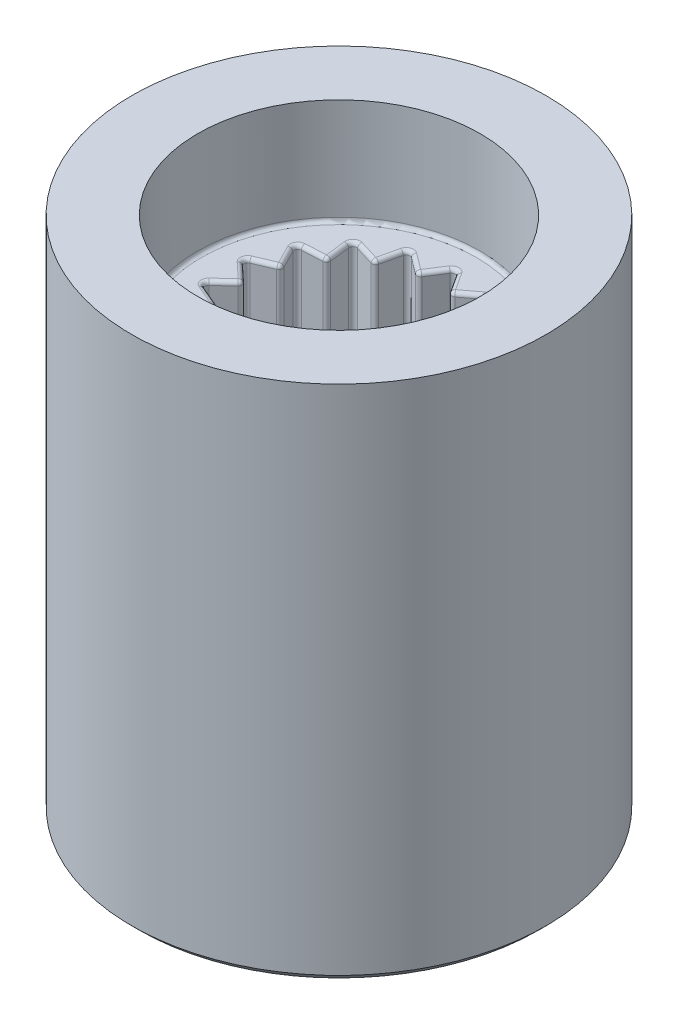
from build123d import *

# Parameters (mm, degrees)
SKETCH2_R           = 5.5
SKETCH2_R_2         = 3.75
BOSS_EXTRUDE1_DEPTH = 13.7
SKETCH3_R           = 4.607658028
BOSS_EXTRUDE2_DEPTH = 10.9
FILLET1_R           = 0.1
EXTRUDE_START       = 0.1
SKETCH_1_R          = 5.5
EXTRUDE_1_DEPTH     = 0.1
CHAMFER_1_SIZE      = 0.2


with BuildPart() as part:
    # Sketch2 → Boss-Extrude1 (new body)
    with BuildSketch(Plane(origin=(0, 0, 0), x_dir=(1, 0, 0), z_dir=(0, 1, 0))):
        with Locations(Location((0, 0, 0), (0, 0, 90))):
            Circle(SKETCH2_R)
        with Locations(Location((0, 0, 0), (0, 0, 90))):
            Circle(SKETCH2_R_2, mode=Mode.SUBTRACT)
    extrude(amount=BOSS_EXTRUDE1_DEPTH)

    # Sketch3 → Boss-Extrude2 (add)
    with BuildSketch(Plane(origin=(0, 0, 0), x_dir=(1, 0, 0), z_dir=(0, 1, 0))):
        Circle(SKETCH3_R)
        Polygon((0, 3.167239607), (0.439078531, 2.490138093), (1.083259744, 2.976231687), (1.264276243, 2.189790688), (2.035862376, 2.426246301), (1.936983582, 1.625322209), (2.74290996, 1.583619804), (2.376062113, 0.864815884), (3.119122121, 0.549985386), (2.528552487, 0), (3.119122121, -0.549985386), (2.376062113, -0.864815884), (2.74290996, -1.583619804), (1.936983582, -1.625322209), (2.035862376, -2.426246301), (1.264276243, -2.189790688), (1.083259744, -2.976231687), (0.439078531, -2.490138093), (0, -3.167239607), (-0.439078531, -2.490138093), (-1.083259744, -2.976231687), (-1.264276243, -2.189790688), (-2.035862376, -2.426246301), (-1.936983582, -1.625322209), (-2.74290996, -1.583619804), (-2.376062113, -0.864815884), (-3.119122121, -0.549985386), (-2.528552487, 0), (-3.119122121, 0.549985386), (-2.376062113, 0.864815884), (-2.74290996, 1.583619804), (-1.936983582, 1.625322209), (-2.035862376, 2.426246301), (-1.264276243, 2.189790688), (-1.083259744, 2.976231687), (-0.439078531, 2.490138093), align=None, mode=Mode.SUBTRACT)
    extrude(amount=BOSS_EXTRUDE2_DEPTH)

    # Fillet1
    fillet1_edges = [part.edges().sort_by_distance(p)[0] for p in [
        (0, 10.9, 3.75),
        (1.986422979, 0, -2.025784255),
        (1.65006931, 0, -2.308018495),
        (1.173767994, 10.9, -2.583011188),
        (1.083259744, 5.45, -2.976231687),
        (1.65006931, 10.9, -2.308018495),
        (1.264276243, 5.45, -2.189790688),
        (1.986422979, 10.9, -2.025784255),
        (2.035862376, 5.45, -2.426246301),
        (2.339946771, 10.9, -1.604471006),
        (1.936983582, 5.45, -1.625322209),
        (2.559486036, 10.9, -1.224217844),
        (2.74290996, 5.45, -1.583619804),
        (2.747592117, 10.9, -0.707400635),
        (2.376062113, 5.45, -0.864815884),
        (2.823837304, 10.9, -0.274992693),
        (3.119122121, 5.45, -0.549985386),
        (2.823837304, 10.9, 0.274992693),
        (2.528552487, 5.45, 0),
        (2.747592117, 10.9, 0.707400635),
        (3.119122121, 5.45, 0.549985386),
        (2.559486036, 10.9, 1.224217844),
        (2.376062113, 5.45, 0.864815884),
        (2.339946771, 10.9, 1.604471006),
        (2.74290996, 5.45, 1.583619804),
        (1.986422979, 10.9, 2.025784255),
        (1.936983582, 5.45, 1.625322209),
        (1.65006931, 10.9, 2.308018495),
        (2.035862376, 5.45, 2.426246301),
        (1.173767994, 10.9, 2.583011188),
        (1.264276243, 5.45, 2.189790688),
        (0.761169138, 10.9, 2.73318489),
        (1.083259744, 5.45, 2.976231687),
        (0.219539266, 10.9, 2.82868885),
        (0.439078531, 5.45, 2.490138093),
        (-0.219539266, 10.9, 2.82868885),
        (0, 5.45, 3.167239607),
        (-0.761169138, 10.9, 2.73318489),
        (-0.439078531, 5.45, 2.490138093),
        (-1.173767994, 10.9, 2.583011188),
        (-1.083259744, 5.45, 2.976231687),
        (-1.65006931, 10.9, 2.308018495),
        (-1.264276243, 5.45, 2.189790688),
        (-1.986422979, 10.9, 2.025784255),
        (-2.035862376, 5.45, 2.426246301),
        (-2.339946771, 10.9, 1.604471006),
        (-1.936983582, 5.45, 1.625322209),
        (-2.559486036, 10.9, 1.224217844),
        (-2.74290996, 5.45, 1.583619804),
        (-2.747592117, 10.9, 0.707400635),
        (-2.376062113, 5.45, 0.864815884),
        (-2.823837304, 10.9, 0.274992693),
        (-3.119122121, 5.45, 0.549985386),
        (-2.823837304, 10.9, -0.274992693),
        (-2.528552487, 5.45, 0),
        (-2.747592117, 10.9, -0.707400635),
        (-3.119122121, 5.45, -0.549985386),
        (-2.559486036, 10.9, -1.224217844),
        (-2.376062113, 5.45, -0.864815884),
        (-2.339946771, 10.9, -1.604471006),
        (-2.74290996, 5.45, -1.583619804),
        (-1.986422979, 10.9, -2.025784255),
        (-1.936983582, 5.45, -1.625322209),
        (-1.65006931, 10.9, -2.308018495),
        (-2.035862376, 5.45, -2.426246301),
        (-1.173767994, 10.9, -2.583011188),
        (-1.264276243, 5.45, -2.189790688),
        (-0.761169138, 10.9, -2.73318489),
        (-1.083259744, 5.45, -2.976231687),
        (-0.219539266, 10.9, -2.82868885),
        (-0.439078531, 5.45, -2.490138093),
        (0.219539266, 10.9, -2.82868885),
        (0, 5.45, -3.167239607),
        (0.761169138, 10.9, -2.73318489),
        (0.439078531, 5.45, -2.490138093),
    ]]
    fillet(fillet1_edges, radius=FILLET1_R)

    # 草图1 → 凸台-拉伸1 (add)
    with BuildSketch(Plane.XZ.offset(EXTRUDE_START)):
        with Locations(Location((0, 0, 0), (0, 0, 270))):
            Circle(SKETCH_1_R)
    extrude(amount=-EXTRUDE_1_DEPTH)

    # 倒角1
    chamfer_1_edges = [part.edges().sort_by_distance(p)[0] for p in [
        (0, -0.1, 5.5),
    ]]
    chamfer(chamfer_1_edges, length=CHAMFER_1_SIZE)


solid = part.part
